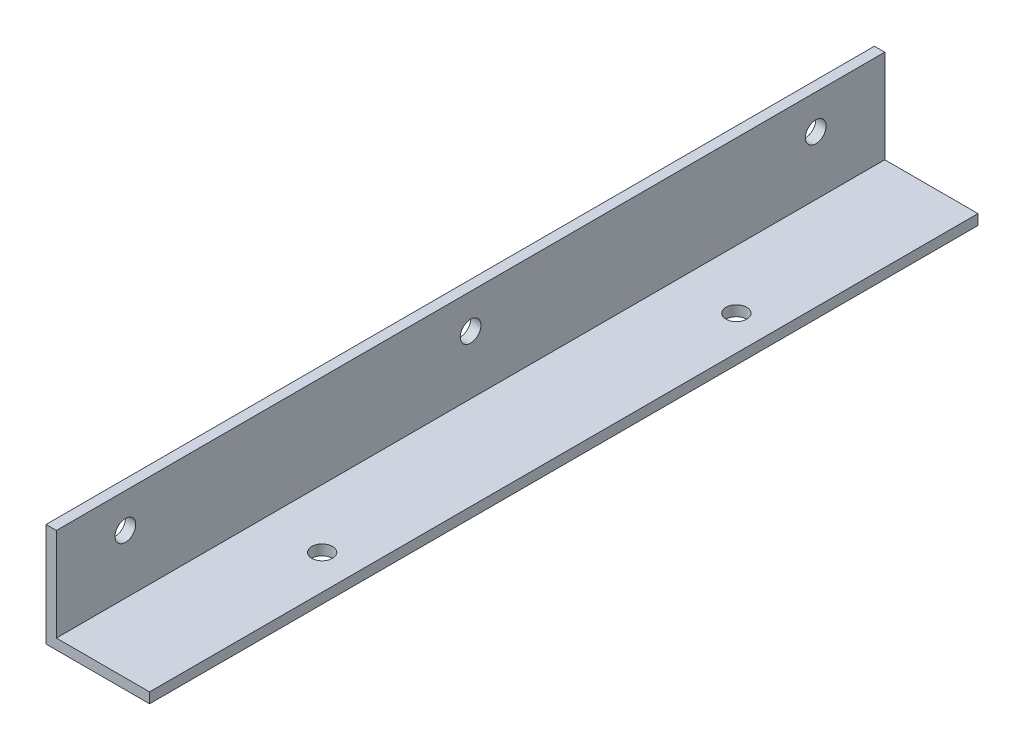
from build123d import *

# Parameters (mm, degrees)
EXTRUSION1_DEPTH                = 120
ESQUISSE2_R                     = 1.5
EXTRUSION2_DEPTH                = 122.86057607
ESQUISSE3_R                     = 1.5
EXTRUSION3_DEPTH                = 120
R_P_TITION_LIN_AIRE1_COUNT      = 2
R_P_TITION_LIN_AIRE1_PITCH      = 60
R_P_TITION_LIN_AIRE2_COUNT      = 2
R_P_TITION_LIN_AIRE2_PITCH      = 50
R_P_TITION_LIN_AIRE2_COUNT_DIR2 = 2
R_P_TITION_LIN_AIRE2_PITCH_DIR2 = 50


with BuildPart() as part:
    # Esquisse1 → Extrusion1 (new body)
    with BuildSketch(Plane.XY):
        Polygon((0, 0), (1.5, 0), (15, 0), (15, 1.5), (1.5, 1.5), (1.5, 15), (0, 15), align=None)
    extrude(amount=EXTRUSION1_DEPTH)

    # Esquisse2 → Extrusion2 (cut, through all)
    with BuildSketch(Plane.ZY):
        with Locations((60, 10)):
            Circle(ESQUISSE2_R)
    extrusion2 = extrude(amount=-EXTRUSION2_DEPTH, mode=Mode.SUBTRACT)

    # Esquisse3 → Extrusion3 (cut)
    with BuildSketch(Plane.XZ):
        with Locations((10, 90)):
            Circle(ESQUISSE3_R)
    extrusion3 = extrude(amount=-EXTRUSION3_DEPTH, mode=Mode.SUBTRACT)

    # Répétition linéaire1: Extrusion3 ×2
    with Locations(*[(0, 0, -i * R_P_TITION_LIN_AIRE1_PITCH) for i in range(1, R_P_TITION_LIN_AIRE1_COUNT)]):
        add(extrusion3, mode=Mode.SUBTRACT)

    # Répétition linéaire2: Extrusion2 2 × 2
    with Locations(*[Vector(0, 0, 1) * (i * R_P_TITION_LIN_AIRE2_PITCH) + Vector(0, 0, -1) * (j * R_P_TITION_LIN_AIRE2_PITCH_DIR2) for i in range(R_P_TITION_LIN_AIRE2_COUNT) for j in range(R_P_TITION_LIN_AIRE2_COUNT_DIR2) if (i, j) != (0, 0)]):
        add(extrusion2, mode=Mode.SUBTRACT)


solid = part.part
